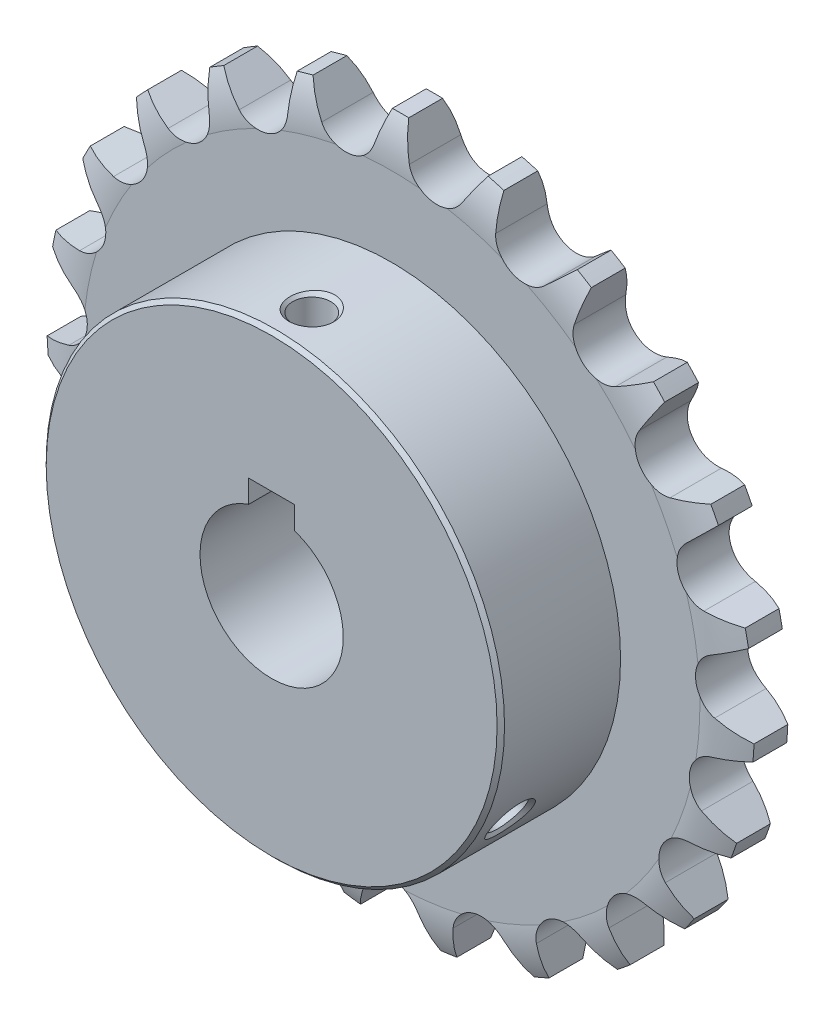
from build123d import *

# Parameters (mm, degrees)
CUT_EXTRUDE1_DEPTH      = 9.2
CUT_EXTRUDE1_DEPTH_BACK = 9.2
SKETCH2_R               = 116.58
SKETCH5_W               = 8
SKETCH5_H               = 15.8
CUT_EXTRUDE2_DEPTH      = 30


with BuildPart() as part:
    # Sketch1 → Revolve1 (revolve)
    with BuildSketch(Plane(origin=(0, 0, 0), x_dir=(0, 0, -1), z_dir=(1, 0, 0)), mode=Mode.PRIVATE) as revolve1_sk:
        with BuildLine():
            Line((-30, 39.35), (-30, 12.5))
            Line((-30, 12.5), (0, 12.5))
            Line((0, 12.5), (0, 53.85))
            ThreePointArc((0, 53.85), (-0.294370756, 57.902405923), (-1.6, 61.75))
            Line((-1.6, 61.75), (-7.5, 61.75))
            ThreePointArc((-7.5, 61.75), (-8.805629244, 57.902405923), (-9.1, 53.85))
            Line((-9.1, 53.85), (-9.1, 40))
            Line((-9.1, 40), (-29.35, 40))
            Line((-29.35, 40), (-30, 39.35))
        make_face()
    revolve(revolve1_sk.sketch.rotate(Axis((0, 0, 0), (0, 0, 1)), 270), axis=Axis((0, 0, 0), (0, 0, 1)))

    # Sketch2 → Cut-Extrude1 (cut, two sides: drawn at the far end of the back side and taken through both)
    with BuildSketch(Plane.XY.offset(-CUT_EXTRUDE1_DEPTH_BACK)):
        Circle(SKETCH2_R)
        with BuildLine():
            Line((-61.703536039, -2.78872238), (-61.508556956, -5.63921567))
            Line((-61.508556956, -5.63921567), (-55.943190128, -6.906182372))
            ThreePointArc((-55.943190128, -6.906182372), (-52.097064306, -10.825894455), (-54.063156811, -15.953399394))
            Line((-54.063156811, -15.953399394), (-58.663013249, -19.332723782))
            Line((-58.663013249, -19.332723782), (-57.706210633, -22.024908322))
            Line((-57.706210633, -22.024908322), (-52.005399179, -21.743374461))
            ThreePointArc((-52.005399179, -21.743374461), (-47.244372471, -24.480060658), (-47.754172657, -29.947869215))
            Line((-47.754172657, -29.947869215), (-51.271723131, -34.442905502))
            Line((-51.271723131, -34.442905502), (-49.624058656, -36.77711428))
            Line((-49.624058656, -36.77711428), (-44.210605681, -34.967959934))
            ThreePointArc((-44.210605681, -34.967959934), (-38.887781659, -36.318652751), (-37.903479977, -41.721242578))
            Line((-37.903479977, -41.721242578), (-40.077843861, -46.998614486))
            Line((-40.077843861, -46.998614486), (-37.861517263, -48.801729916))
            Line((-37.861517263, -48.801729916), (-33.13691381, -45.599131788))
            ThreePointArc((-33.13691381, -45.599131788), (-27.647061981, -45.463656516), (-25.241659584, -50.400342242))
            Line((-25.241659584, -50.400342242), (-25.911574256, -56.068651239))
            Line((-25.911574256, -56.068651239), (-23.29096034, -57.206944497))
            Line((-23.29096034, -57.206944497), (-19.605608633, -52.848424639))
            ThreePointArc((-19.605608633, -52.848424639), (-14.355886193, -51.23682886), (-10.707780773, -55.341479087))
            Line((-10.707780773, -55.341479087), (-9.823561726, -60.980332626))
            Line((-9.823561726, -60.980332626), (-6.993019437, -61.369381709))
            Line((-6.993019437, -61.369381709), (-4.620245154, -56.178191599))
            ThreePointArc((-4.620245154, -56.178191599), (0, -53.21), (4.620245154, -56.178191599))
            Line((4.620245154, -56.178191599), (6.993019437, -61.369381709))
            Line((6.993019437, -61.369381709), (9.823561726, -60.980332626))
            Line((9.823561726, -60.980332626), (10.707780773, -55.341479087))
            ThreePointArc((10.707780773, -55.341479087), (14.355886193, -51.23682886), (19.605608633, -52.848424639))
            Line((19.605608633, -52.848424639), (23.29096034, -57.206944497))
            Line((23.29096034, -57.206944497), (25.911574256, -56.068651239))
            Line((25.911574256, -56.068651239), (25.241659584, -50.400342242))
            ThreePointArc((25.241659584, -50.400342242), (27.647061981, -45.463656516), (33.13691381, -45.599131788))
            Line((33.13691381, -45.599131788), (37.861517263, -48.801729916))
            Line((37.861517263, -48.801729916), (40.077843861, -46.998614486))
            Line((40.077843861, -46.998614486), (37.903479977, -41.721242578))
            ThreePointArc((37.903479977, -41.721242578), (38.887781659, -36.318652751), (44.210605681, -34.967959934))
            Line((44.210605681, -34.967959934), (49.624058656, -36.77711428))
            Line((49.624058656, -36.77711428), (51.271723131, -34.442905502))
            Line((51.271723131, -34.442905502), (47.754172657, -29.947869215))
            ThreePointArc((47.754172657, -29.947869215), (47.244372471, -24.480060658), (52.005399179, -21.743374461))
            Line((52.005399179, -21.743374461), (57.706210633, -22.024908322))
            Line((57.706210633, -22.024908322), (58.663013249, -19.332723782))
            Line((58.663013249, -19.332723782), (54.063156811, -15.953399394))
            ThreePointArc((54.063156811, -15.953399394), (52.097064306, -10.825894455), (55.943190128, -6.906182372))
            Line((55.943190128, -6.906182372), (61.508556956, -5.63921567))
            Line((61.508556956, -5.63921567), (61.703536039, -2.78872238))
            Line((61.703536039, -2.78872238), (56.362523948, -0.775738923))
            ThreePointArc((56.362523948, -0.775738923), (53.085955209, 3.631178815), (55.731930589, 8.443209669))
            Line((55.731930589, 8.443209669), (60.749094993, 11.164711809))
            Line((60.749094993, 11.164711809), (60.167789836, 13.962105803))
            Line((60.167789836, 13.962105803), (54.481740525, 14.459454556))
            ThreePointArc((54.481740525, 14.459454556), (50.137703666, 17.818944164), (51.387288714, 23.166407474))
            Line((51.387288714, 23.166407474), (55.484150562, 27.140603689))
            Line((55.484150562, 27.140603689), (54.169673911, 29.677428471))
            Line((54.169673911, 29.677428471), (48.560295644, 28.622256439))
            ThreePointArc((48.560295644, 28.622256439), (43.470968007, 30.68515994), (43.231486717, 36.171458816))
            Line((43.231486717, 36.171458816), (46.104200508, 41.103601153))
            Line((46.104200508, 41.103601153), (44.154041081, 43.191712034))
            Line((44.154041081, 43.191712034), (39.037355784, 40.662276499))
            ThreePointArc((39.037355784, 40.662276499), (33.580189518, 41.275597778), (31.869403121, 46.493838531))
            Line((31.869403121, 46.493838531), (33.304912814, 52.018132556))
            Line((33.304912814, 52.018132556), (30.863705015, 53.502663905))
            Line((30.863705015, 53.502663905), (26.619193829, 49.686561529))
            ThreePointArc((26.619193829, 49.686561529), (21.198921991, 48.804813353), (18.143711688, 53.367982938))
            Line((18.143711688, 53.367982938), (18.035552097, 59.074717035))
            Line((18.035552097, 59.074717035), (15.284349141, 59.845567952))
            Line((15.284349141, 59.845567952), (12.226808043, 55.025821591))
            ThreePointArc((12.226808043, 55.025821591), (7.245427398, 52.714399189), (3.072384162, 56.284068192))
            Line((3.072384162, 56.284068192), (1.428576988, 61.75))
            Line((1.428576988, 61.75), (-1.428576988, 61.75))
            Line((-1.428576988, 61.75), (-3.072384162, 56.284068192))
            ThreePointArc((-3.072384162, 56.284068192), (-7.245427398, 52.714399189), (-12.226808043, 55.025821591))
            Line((-12.226808043, 55.025821591), (-15.284349141, 59.845567952))
            Line((-15.284349141, 59.845567952), (-18.035552097, 59.074717035))
            Line((-18.035552097, 59.074717035), (-18.143711688, 53.367982938))
            ThreePointArc((-18.143711688, 53.367982938), (-21.198921991, 48.804813353), (-26.619193829, 49.686561529))
            Line((-26.619193829, 49.686561529), (-30.863705015, 53.502663905))
            Line((-30.863705015, 53.502663905), (-33.304912814, 52.018132556))
            Line((-33.304912814, 52.018132556), (-31.869403121, 46.493838531))
            ThreePointArc((-31.869403121, 46.493838531), (-33.580189518, 41.275597778), (-39.037355784, 40.662276499))
            Line((-39.037355784, 40.662276499), (-44.154041081, 43.191712034))
            Line((-44.154041081, 43.191712034), (-46.104200508, 41.103601153))
            Line((-46.104200508, 41.103601153), (-43.231486717, 36.171458816))
            ThreePointArc((-43.231486717, 36.171458816), (-43.470968007, 30.68515994), (-48.560295644, 28.622256439))
            Line((-48.560295644, 28.622256439), (-54.169673911, 29.677428471))
            Line((-54.169673911, 29.677428471), (-55.484150562, 27.140603689))
            Line((-55.484150562, 27.140603689), (-51.387288714, 23.166407474))
            ThreePointArc((-51.387288714, 23.166407474), (-50.137703666, 17.818944164), (-54.481740525, 14.459454556))
            Line((-54.481740525, 14.459454556), (-60.167789836, 13.962105803))
            Line((-60.167789836, 13.962105803), (-60.749094993, 11.164711809))
            Line((-60.749094993, 11.164711809), (-55.731930589, 8.443209669))
            ThreePointArc((-55.731930589, 8.443209669), (-53.085955209, 3.631178815), (-56.362523948, -0.775738923))
            Line((-56.362523948, -0.775738923), (-61.703536039, -2.78872238))
        make_face(mode=Mode.SUBTRACT)
    extrude(amount=CUT_EXTRUDE1_DEPTH + CUT_EXTRUDE1_DEPTH_BACK, mode=Mode.SUBTRACT)

    # Sketch3 → Cut-Revolve1 (revolve, cut)
    with BuildSketch(Plane.XY.offset(23), mode=Mode.PRIVATE) as cut_revolve1_sk:
        Polygon((0, 12), (-3.3235, 12), (-3.3235, 39.3235), (-4, 40), (0, 40), align=None)
    revolve(cut_revolve1_sk.sketch.rotate(Axis((0, 40, 23), (0, -1, 0)), 180), axis=Axis((0, 40, 23), (0, -1, 0)), mode=Mode.SUBTRACT)

    # Sketch4 → Cut-Revolve2 (revolve, cut)
    with BuildSketch(Plane.XY.offset(23), mode=Mode.PRIVATE) as cut_revolve2_sk:
        Polygon((0, 0), (1.66175, 2.878235429), (35.716899966, -16.783514571), (36.641016151, -16.535898385), (34.641016151, -20), align=None)
    revolve(cut_revolve2_sk.sketch.rotate(Axis((34.641016151, -20, 23), (-0.8660254037844384, 0.5000000000000006, 0)), 180), axis=Axis((34.641016151, -20, 23), (-0.8660254037844384, 0.5000000000000006, 0)), mode=Mode.SUBTRACT)

    # Sketch5 → Cut-Extrude2 (cut)
    with BuildSketch(Plane.XY):
        with Locations((0, 7.9)):
            Rectangle(SKETCH5_W, SKETCH5_H)
    extrude(amount=CUT_EXTRUDE2_DEPTH, mode=Mode.SUBTRACT)


solid = part.part
